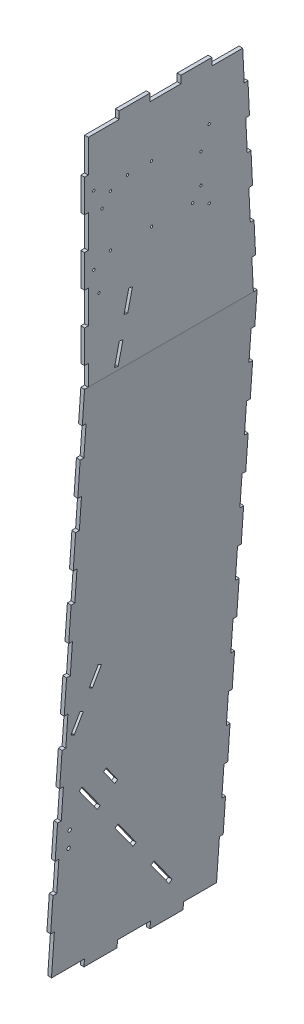
from build123d import *

# Parameters (mm, degrees)
BOSS_EXTRUDE1_DEPTH      = 469.9
SKETCH2_W                = 10.16
SKETCH2_H                = 83.651125112
SKETCH2_H_2              = 83.677721465
SKETCH2_H_3              = 83.704317819
SKETCH2_H_4              = 83.730914172
SKETCH2_H_5              = 83.757510526
SKETCH2_H_6              = 83.784106879
SKETCH2_H_7              = 83.810703233
SKETCH2_H_8              = 133.264269193
CUT_EXTRUDE1_DEPTH       = 10.16
SKETCH3_W                = 10.16
SKETCH3_H                = 55.879999965
SKETCH3_H_2              = 88.9
SKETCH3_H_3              = 109.22
CUT_EXTRUDE2_DEPTH       = 12.7
SKETCH4_W                = 84.113540858
SKETCH4_H                = 20.32
CUT_EXTRUDE3_DEPTH       = 12.7
SKETCH5_W                = 89.916
SKETCH5_H                = 20.32
CUT_EXTRUDE4_DEPTH       = 12.7
SKETCH13_R               = 3.175
CUT_EXTRUDE8_DEPTH       = 2128.667464702
CUT_EXTRUDE9_DEPTH       = 2128.667464702
SKETCH20_R               = 4.7625
CUT_EXTRUDE10_DEPTH      = 2107.728843747
SKETCH24_R               = 3.175
CUT_EXTRUDE12_DEPTH      = 12.7
CUT_EXTRUDE13_DEPTH      = 2128.667464702
CUT_EXTRUDE13_DEPTH_BACK = 2128.667464702


with BuildPart() as part:
    # Sketch1 → Boss-Extrude1 (new body)
    with BuildSketch(Plane.XY):
        Polygon((-215.881789204, 2052.32), (-215.881789204, 1463.040000035), (-316.088635901, 20.32), (-317.499999939, 0), (-307.333509538, 0), (-205.715298803, 1463.040000035), (-205.715298803, 2072.64), (-215.881789204, 2072.64), align=None)
    extrude(amount=-BOSS_EXTRUDE1_DEPTH)

    # Sketch2 → Cut-Extrude1 (cut)
    with BuildSketch(Plane(origin=(-315.975651309, 21.946686571, 0), x_dir=(0, 0, 1), z_dir=(-0.9975965627192115, 0.06928995634877068, 0))):
        with Locations((-464.82, 1313.852971026)):
            Rectangle(SKETCH2_W, SKETCH2_H)
        with Locations((-464.82, 1136.066269203)):
            Rectangle(SKETCH2_W, SKETCH2_H_2)
        with Locations((-464.82, 958.27956738)):
            Rectangle(SKETCH2_W, SKETCH2_H_3)
        with Locations((-464.82, 780.492865556)):
            Rectangle(SKETCH2_W, SKETCH2_H_4)
        with Locations((-464.82, 602.706163733)):
            Rectangle(SKETCH2_W, SKETCH2_H_5)
        with Locations((-464.82, 424.91946191)):
            Rectangle(SKETCH2_W, SKETCH2_H_6)
        with Locations((-464.82, 247.132760087)):
            Rectangle(SKETCH2_W, SKETCH2_H_7)
        with Locations((-464.82, 44.63257346)):
            Rectangle(SKETCH2_W, SKETCH2_H_8)
        with Locations((-5.08, 44.63257346)):
            Rectangle(SKETCH2_W, SKETCH2_H_8)
        with Locations((-5.08, 247.132760087)):
            Rectangle(SKETCH2_W, SKETCH2_H_7)
        with Locations((-5.08, 424.91946191)):
            Rectangle(SKETCH2_W, SKETCH2_H_6)
        with Locations((-5.08, 602.706163733)):
            Rectangle(SKETCH2_W, SKETCH2_H_5)
        with Locations((-5.08, 780.492865556)):
            Rectangle(SKETCH2_W, SKETCH2_H_4)
        with Locations((-5.08, 958.27956738)):
            Rectangle(SKETCH2_W, SKETCH2_H_3)
        with Locations((-5.08, 1136.066269203)):
            Rectangle(SKETCH2_W, SKETCH2_H_2)
        with Locations((-5.08, 1313.852971026)):
            Rectangle(SKETCH2_W, SKETCH2_H)
    extrude(amount=-CUT_EXTRUDE1_DEPTH, mode=Mode.SUBTRACT)

    # Sketch3 → Cut-Extrude2 (cut)
    with BuildSketch(Plane.ZY.offset(215.881789204)):
        with Locations((-5.08, 1490.980000018)):
            Rectangle(SKETCH3_W, SKETCH3_H)
        with Locations((-5.08, 1652.27)):
            Rectangle(SKETCH3_W, SKETCH3_H_2)
        Polygon((-469.9, 1463.040000035), (-459.727704291, 1463.040000035), (-455.605912768, 1546.794803777), (-465.753631921, 1547.294199405), (-461.607263841, 1631.548398775), (-451.459544688, 1631.049003148), (-447.313176609, 1715.303202518), (-457.460895762, 1715.802598146), (-453.314527682, 1800.056797516), (-443.166808529, 1799.557401889), (-439.02044045, 1883.811601259), (-449.168159603, 1884.310996887), (-445.021791523, 1968.565196257), (-434.87407237, 1968.06580063), (-429.727704291, 2072.64), (-469.9, 2072.64), align=None)
        with Locations((-5.08, 1830.07)):
            Rectangle(SKETCH3_W, SKETCH3_H_2)
        with Locations((-5.08, 2018.03)):
            Rectangle(SKETCH3_W, SKETCH3_H_3)
    extrude(amount=-CUT_EXTRUDE2_DEPTH, mode=Mode.SUBTRACT)

    # Sketch4 → Cut-Extrude3 (cut)
    with BuildSketch(Plane.ZY.offset(215.881789204)):
        with Locations((-388.670933862, 2062.48)):
            Rectangle(SKETCH4_W, SKETCH4_H)
        with Locations((-220.443852145, 2062.48)):
            Rectangle(SKETCH4_W, SKETCH4_H)
        with Locations((-52.216770429, 2062.48)):
            Rectangle(SKETCH4_W, SKETCH4_H)
    extrude(amount=-CUT_EXTRUDE3_DEPTH, mode=Mode.SUBTRACT)

    # Sketch5 → Cut-Extrude4 (cut)
    with BuildSketch(Plane(origin=(-315.975651309, 21.946686571, 0), x_dir=(0, 0, 1), z_dir=(-0.9975965627192115, 0.06928995634877068, 0))):
        with Locations((-414.782, -11.839561137)):
            Rectangle(SKETCH5_W, SKETCH5_H)
        with Locations((-234.95, -11.839561137)):
            Rectangle(SKETCH5_W, SKETCH5_H)
        with Locations((-55.118, -11.839561137)):
            Rectangle(SKETCH5_W, SKETCH5_H)
    extrude(amount=-CUT_EXTRUDE4_DEPTH, mode=Mode.SUBTRACT)

    # Sketch13 → Cut-Extrude8 (cut, through all)
    with BuildSketch(Plane.ZY.offset(215.881789204)):
        with Locations((-25.246459893, 1731.87)):
            Circle(SKETCH13_R)
        with Locations((-70.408959893, 1755.42)):
            Circle(SKETCH13_R)
        with Locations((-182.408959893, 1755.42)):
            Circle(SKETCH13_R)
        with Locations((-25.246459893, 1918.97)):
            Circle(SKETCH13_R)
        with Locations((-47.788959893, 1865.42)):
            Circle(SKETCH13_R)
        with Locations((-182.408959893, 1910.42)):
            Circle(SKETCH13_R)
        with Locations((-117.078959893, 1910.42)):
            Circle(SKETCH13_R)
        with Locations((-70.408959893, 1895.42)):
            Circle(SKETCH13_R)
        with Locations((-317.028959893, 1865.42)):
            Circle(SKETCH13_R)
        with Locations((-294.408959893, 1755.42)):
            Circle(SKETCH13_R)
        with Locations((-317.028959893, 1785.42)):
            Circle(SKETCH13_R)
        with Locations((-339.571459893, 1731.87)):
            Circle(SKETCH13_R)
        with Locations((-339.571459893, 1918.97)):
            Circle(SKETCH13_R)
    extrude(amount=-CUT_EXTRUDE8_DEPTH, mode=Mode.SUBTRACT)

    # Sketch17 → Cut-Extrude9 (cut, through all)
    with BuildSketch(Plane.ZY.offset(215.881789204)):
        Polygon((-120.524654614, 1641.945974367), (-130.424254473, 1639.660471655), (-117.483615058, 1583.608404231), (-107.584015199, 1585.893906943), align=None)
        Polygon((-94.643375784, 1529.841839519), (-104.542975642, 1527.556336807), (-91.602336227, 1471.504269383), (-81.702736369, 1473.789772095), align=None)
    extrude(amount=-CUT_EXTRUDE9_DEPTH, mode=Mode.SUBTRACT)

    # Sketch20 → Cut-Extrude10 (cut, through all)
    with BuildSketch(Plane(origin=(-315.975651309, 21.946686571, 0), x_dir=(0, 0, 1), z_dir=(-0.9975965627192116, 0.06928995634876853, 0))):
        Polygon((-128.598334701, 451.361418049), (-162.492565561, 405.347250509), (-154.823537638, 399.698212032), (-120.929306778, 445.712379572), align=None)
        with Locations((-35.56, 347.287639338)):
            Circle(SKETCH20_R)
        with Locations((-35.56, 302.837639338)):
            Circle(SKETCH20_R)
    extrude(amount=-CUT_EXTRUDE10_DEPTH, mode=Mode.SUBTRACT)

    # Sketch24 → Cut-Extrude12 (cut)
    with BuildSketch(Plane.ZY.offset(215.881789204)):
        with Locations((-39.313746491, 1670.454214013)):
            Circle(SKETCH24_R)
    extrude(amount=-CUT_EXTRUDE12_DEPTH, mode=Mode.SUBTRACT)

    # Sketch26 → Cut-Extrude13 (cut, two sides: drawn at the far end of the back side and taken through both)
    with BuildSketch(Plane.ZY.offset(215.881789204).offset(-CUT_EXTRUDE13_DEPTH_BACK)):
        Polygon((-96.478494721, 741.073656933), (-74.89887104, 694.944067742), (-65.68812669, 699.232207156), (-87.26775037, 745.361796346), align=None)
        Polygon((-31.73962368, 602.684889361), (-22.52887933, 606.973028774), (-44.10850301, 653.102617965), (-53.31924736, 648.814478552), align=None)
        Polygon((-63.755697238, 458.569669358), (-117.688081031, 385.528057798), (-109.500847052, 379.511801077), (-55.568463259, 452.553412636), align=None)
        Polygon((-333.417616206, 93.36161156), (-325.230382227, 87.345354838), (-271.297998434, 160.386966398), (-279.485232413, 166.403223119), align=None)
        Polygon((-225.552848619, 239.444834679), (-217.372552167, 233.433675887), (-163.440168374, 306.475287447), (-171.620464825, 312.486446238), align=None)
    extrude(amount=CUT_EXTRUDE13_DEPTH + CUT_EXTRUDE13_DEPTH_BACK, mode=Mode.SUBTRACT)


solid = part.part
